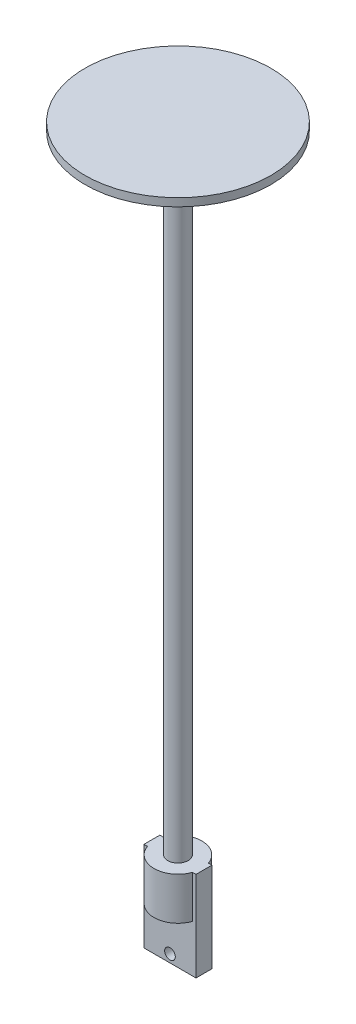
from build123d import *

# Parameters (mm, degrees)
SKETCH1_W           = 9.8
SKETCH1_H           = 8.9
SKETCH1_R           = 1
BOSS_EXTRUDE2_DEPTH = 3
BOSS_EXTRUDE4_DEPTH = 10
SKETCH4_R           = 1.925
BOSS_EXTRUDE5_DEPTH = 116
CUT_EXTRUDE1_START  = -2
CUT_EXTRUDE1_DEPTH  = 2
BOSS_EXTRUDE6_REACH = 122.306
SKETCH9_R           = 1.925


with BuildPart() as part:
    # Sketch1 → Boss-Extrude2 (new body)
    with BuildSketch(Plane.XY):
        Rectangle(SKETCH1_W, SKETCH1_H)
        with Locations((0, -2.95)):
            Circle(SKETCH1_R, mode=Mode.SUBTRACT)
    extrude(amount=BOSS_EXTRUDE2_DEPTH)

    # Sketch3 → Boss-Extrude4 (add)
    with BuildSketch(Plane(origin=(0, 4.45, 0), x_dir=(1, 0, 0), z_dir=(0, 1, 0))):
        with BuildLine():
            Line((4.9, -3), (4.9, 0))
            Line((4.9, 0), (4.242640687, 0))
            ThreePointArc((4.242640687, 0), (0, 3), (-4.242640687, 0))
            Line((-4.242640687, 0), (-4.9, 0))
            Line((-4.9, 0), (-4.9, -3))
            Line((-4.9, -3), (-4.242640687, -3))
            ThreePointArc((-4.242640687, -3), (0, -6), (4.242640687, -3))
            Line((4.242640687, -3), (4.9, -3))
        make_face()
    extrude(amount=BOSS_EXTRUDE4_DEPTH)

    # Sketch4 → Boss-Extrude5 (add)
    with BuildSketch(Plane(origin=(0, 14.45, 0), x_dir=(1, 0, 0), z_dir=(0, 1, 0))):
        with Locations(Location((0, -1.5, 0), (0, 0, 90))):
            Circle(SKETCH4_R)
    extrude(amount=BOSS_EXTRUDE5_DEPTH)

    # Sketch7 → Revolve1 (revolve)
    with BuildSketch(Plane.XY.offset(1.5)):
        with BuildLine():
            Line((3.230940108, 123.05), (6.92598183, 129.45))
            ThreePointArc((6.92598183, 129.45), (7.658032638, 130.182050808), (8.658032638, 130.45))
            Line((8.658032638, 130.45), (17.5, 130.45))
            Line((17.5, 130.45), (17.5, 131.95))
            Line((17.5, 131.95), (0, 131.95))
            Line((0, 131.95), (0, 130.45))
            Line((0, 130.45), (1.925, 130.45))
            Line((1.925, 130.45), (1.925, 122.65))
            Line((1.925, 122.65), (2.538119785, 122.65))
            ThreePointArc((2.538119785, 122.65), (2.938119785, 122.757179677), (3.230940108, 123.05))
        make_face()
    revolve(axis=Axis((0, 130.45, 1.5), (0, 1, 0)))

    # Sketch8 → Cut-Extrude1 (cut)
    with BuildSketch(Plane(origin=(0, 14.45, 0), x_dir=(1, 0, 0), z_dir=(0, 1, 0)).offset(CUT_EXTRUDE1_START)):
        with BuildLine():
            Line((-4.242640687, 0), (-4.9, 0))
            Line((-4.9, 0), (-4.9, -3))
            Line((-4.9, -3), (-4.242640687, -3))
            ThreePointArc((-4.242640687, -3), (0, -6), (4.242640687, -3))
            Line((4.242640687, -3), (4.9, -3))
            Line((4.9, -3), (4.9, 0))
            Line((4.9, 0), (4.242640687, 0))
            ThreePointArc((4.242640687, 0), (0, 3), (-4.242640687, 0))
        make_face()
    extrude(amount=CUT_EXTRUDE1_DEPTH, mode=Mode.SUBTRACT)


with BuildPart() as cut_extrude1_piece_1:
    # of the separate pieces the step leaves, piece 1, a body of its own (cut_extrude1_pieces)
    add(part.part.solids().sort_by_distance((0, 14.45, -0.425))[0])


with BuildPart() as cut_extrude1_piece_2:
    # of the separate pieces the step leaves, piece 2, a body of its own (cut_extrude1_pieces)
    add(part.part.solids().sort_by_distance((4.9, -4.45, 0))[0])

    # Sketch9 → Boss-Extrude6 (add, up to next)
    with BuildSketch(Plane.XZ.offset(-14.45), mode=Mode.PRIVATE) as boss_extrude6_sk1:
        with Locations(Location((0, 1.5, 0), (0, 0, 270))):
            Circle(SKETCH9_R)
    boss_extrude6_tool1 = extrude(boss_extrude6_sk1.sketch, amount=BOSS_EXTRUDE6_REACH, mode=Mode.PRIVATE) - cut_extrude1_piece_2.part

    add(cut_extrude1_piece_1.part)  # Boss-Extrude6 merges Cut-Extrude1 piece 1
    add(boss_extrude6_tool1.solids().sort_by_distance((0, 14.45, 1.5))[0])


solid = cut_extrude1_piece_2.part
